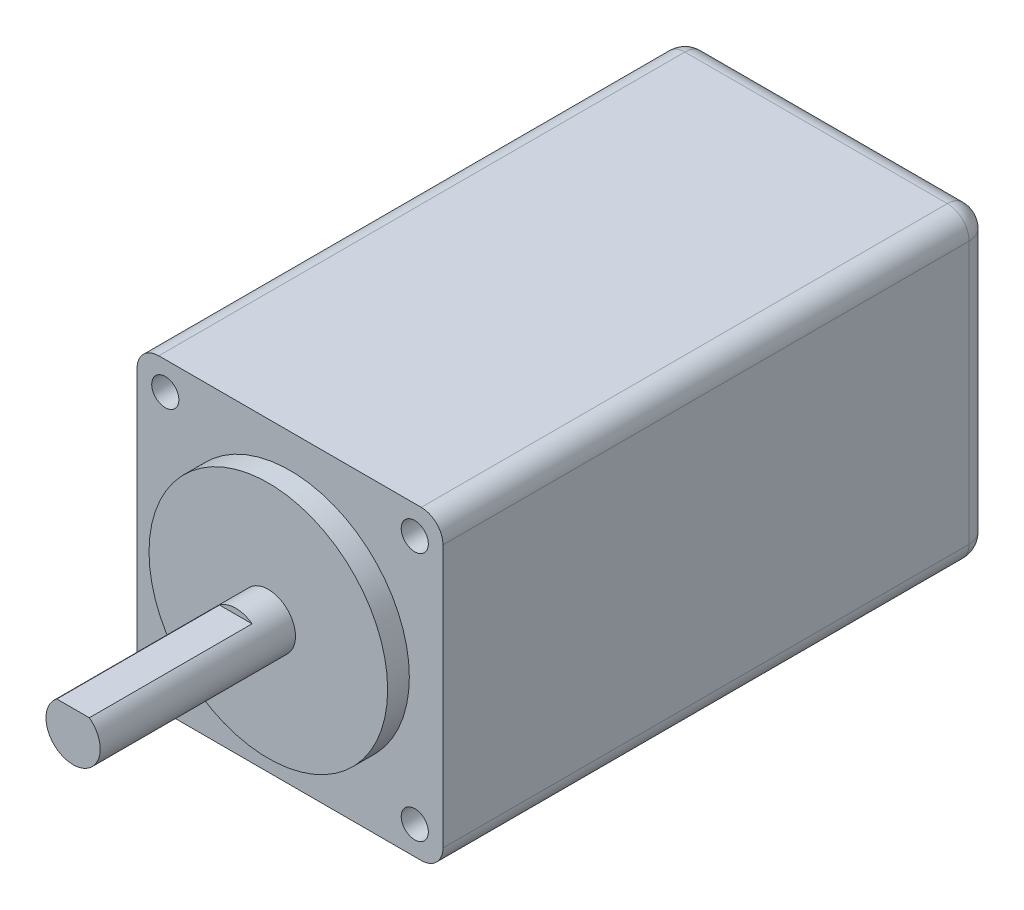
from build123d import *

# Parameters (mm, degrees)
SKETCH1_W           = 28.2
SKETCH1_H           = 28.2
BOSS_EXTRUDE1_DEPTH = 50.5
SKETCH2_R           = 11
BOSS_EXTRUDE2_DEPTH = 2
SKETCH3_R           = 2.5
BOSS_EXTRUDE3_DEPTH = 18
SKETCH4_W           = 15
SKETCH4_H           = 0.5
CUT_EXTRUDE1_DEPTH  = 5
SKETCH5_R           = 1.25
CUT_EXTRUDE2_DEPTH  = 2.5
FILLET1_R           = 2


with BuildPart() as part:
    # Sketch1 → Boss-Extrude1 (new body)
    with BuildSketch(Plane.XY):
        Rectangle(SKETCH1_W, SKETCH1_H)
    extrude(amount=BOSS_EXTRUDE1_DEPTH)

    # Sketch2 → Boss-Extrude2 (add)
    with BuildSketch(Plane.XY.offset(50.5)):
        with Locations(Location((0, 0, 0), (0, 0, 180))):
            Circle(SKETCH2_R)
    extrude(amount=BOSS_EXTRUDE2_DEPTH)

    # Sketch3 → Boss-Extrude3 (add)
    with BuildSketch(Plane.XY.offset(52.5)):
        Circle(SKETCH3_R)
    extrude(amount=BOSS_EXTRUDE3_DEPTH)

    # Sketch4 → Cut-Extrude1 (cut, symmetric)
    with BuildSketch(Plane(origin=(0, 0, 0), x_dir=(0, 0, -1), z_dir=(1, 0, 0))):
        with Locations((-63, 2.25)):
            Rectangle(SKETCH4_W, SKETCH4_H)
    extrude(amount=CUT_EXTRUDE1_DEPTH, both=True, mode=Mode.SUBTRACT)

    # Sketch5 → Cut-Extrude2 (cut)
    with BuildSketch(Plane.XY.offset(50.5)):
        with Locations((-11.5, 11.5)):
            Circle(SKETCH5_R)
        with Locations((11.5, 11.5)):
            Circle(SKETCH5_R)
        with Locations((11.5, -11.5)):
            Circle(SKETCH5_R)
        with Locations((-11.5, -11.5)):
            Circle(SKETCH5_R)
    extrude(amount=-CUT_EXTRUDE2_DEPTH, mode=Mode.SUBTRACT)

    # Fillet1
    fillet1_edges = [part.edges().sort_by_distance(p)[0] for p in [
        (0, -14.1, 0),
        (-14.1, 0, 0),
        (0, 14.1, 0),
        (14.1, 0, 0),
        (14.1, -14.1, 25.25),
        (-14.1, -14.1, 25.25),
        (-14.1, 14.1, 25.25),
        (14.1, 14.1, 25.25),
    ]]
    fillet(fillet1_edges, radius=FILLET1_R)


solid = part.part
